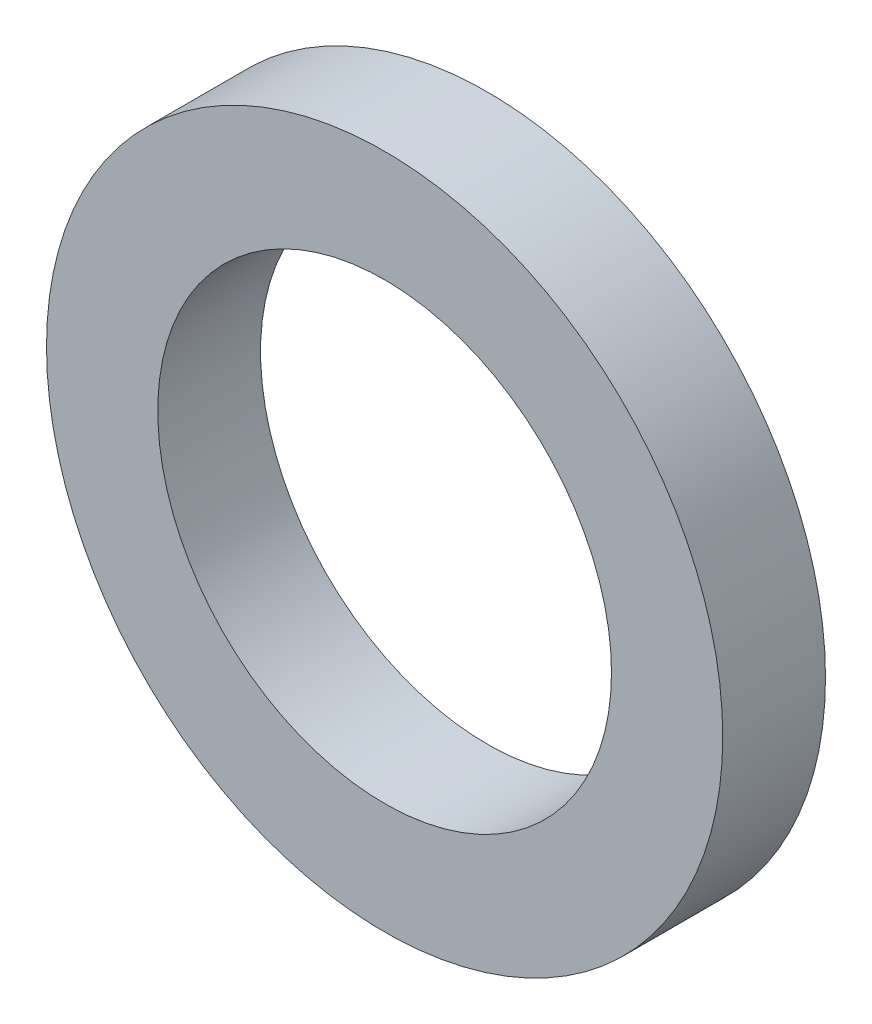
from build123d import *

# Parameters (mm, degrees)
SKETCH2_R           = 6.436168178
SKETCH2_R_2         = 4.318
BOSS_EXTRUDE1_DEPTH = 1.9558


with BuildPart() as part:
    # Sketch2 → Boss-Extrude1 (new body)
    with BuildSketch(Plane.XY):
        with Locations((7.62, -54.61)):
            Circle(SKETCH2_R)
        with Locations((7.62, -54.61)):
            Circle(SKETCH2_R_2, mode=Mode.SUBTRACT)
    extrude(amount=BOSS_EXTRUDE1_DEPTH)


solid = part.part
